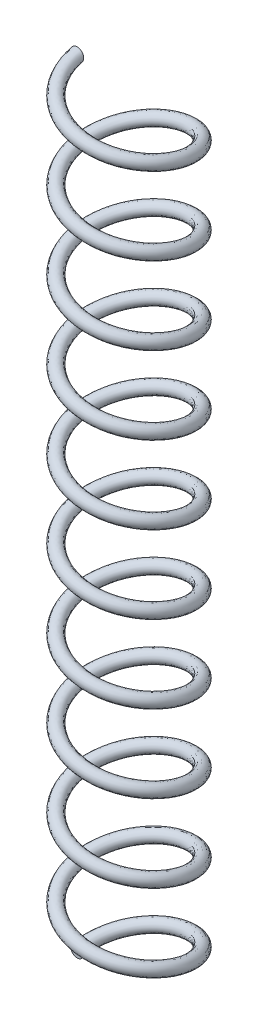
from build123d import *

# Parameters (mm, degrees)
BALAYAGE1_PITCH       = 6
BALAYAGE1_HEIGHT      = 60
BALAYAGE1_RADIUS      = 4
BALAYAGE1_START_ANGLE = -90
ESQUISSE2_R           = 0.5


with BuildPart() as part:
    # Balayage1: sweep along a helix
    with BuildLine() as balayage1_path:
        add(Helix(BALAYAGE1_PITCH, BALAYAGE1_HEIGHT, BALAYAGE1_RADIUS, center=(0, 0, 0), direction=(0, 1, 0), lefthand=True, mode=Mode.PRIVATE).rotate(Axis((0, 0, 0), (0, 1, 0)), BALAYAGE1_START_ANGLE))
    # Esquisse2 → Balayage1 (sweep)
    with BuildSketch(Plane.XY):
        with Locations((-4, 0)):
            Circle(ESQUISSE2_R)
    sweep(path=balayage1_path.line, is_frenet=True)


solid = part.part
